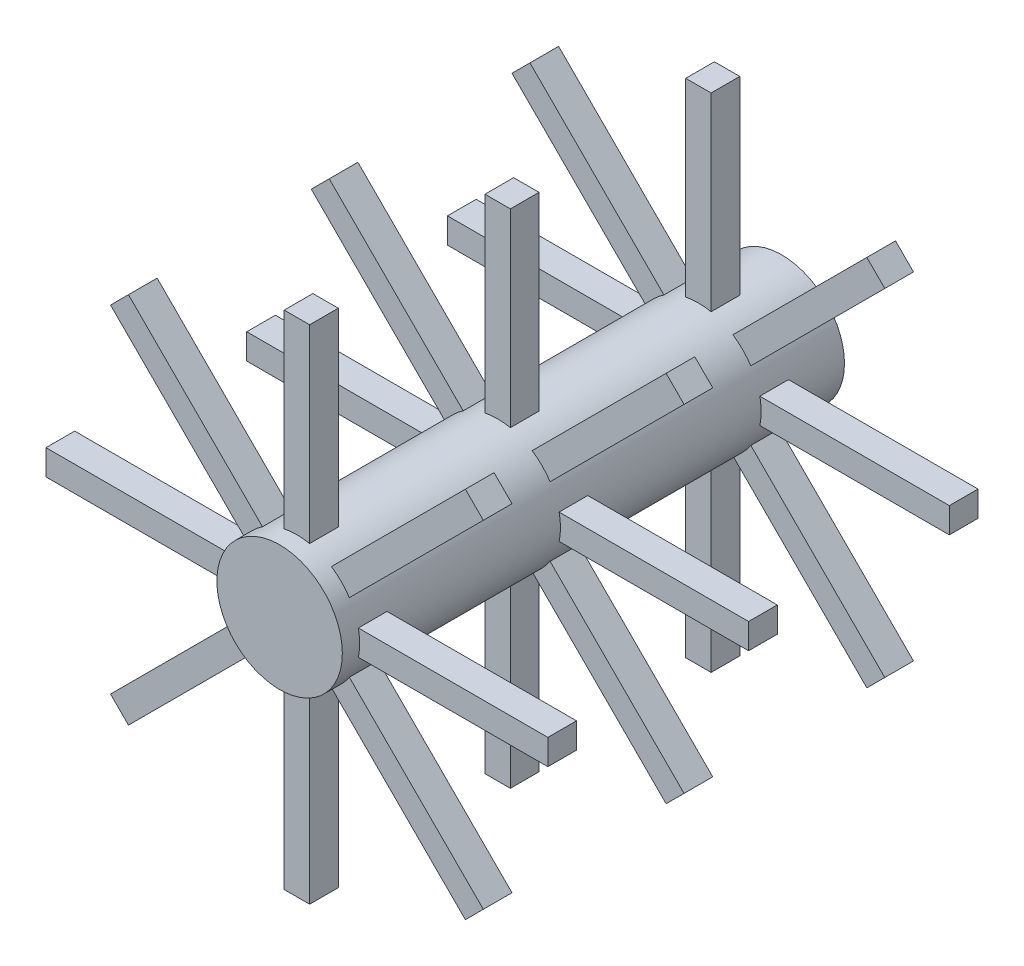
from build123d import *

# Parameters (mm, degrees)
SKETCH1_R                  = 25.4
BOSS_EXTRUDE1_DEPTH        = 203.31507114
SKETCH3_W                  = 11.610363297
SKETCH3_H                  = 10.2808948
BOSS_EXTRUDE3_DEPTH        = 101.6
CIRPATTERN4_COUNT          = 8
LPATTERN1_COUNT            = 3
LPATTERN1_PITCH            = 81.28
LPATTERN1_COPY_1_SKETCH_W  = 11.610363297
LPATTERN1_COPY_1_SKETCH_H  = 10.2808948
LPATTERN1_COPY_1_DEPTH     = 101.6
LPATTERN1_COPY_2_SKETCH_W  = 11.610363297
LPATTERN1_COPY_2_SKETCH_H  = 10.2808948
LPATTERN1_COPY_2_DEPTH     = 101.6
LPATTERN1_COPY_3_SKETCH_W  = 11.610363297
LPATTERN1_COPY_3_SKETCH_H  = 10.2808948
LPATTERN1_COPY_3_DEPTH     = 101.6
LPATTERN1_COPY_4_SKETCH_W  = 11.610363297
LPATTERN1_COPY_4_SKETCH_H  = 10.2808948
LPATTERN1_COPY_4_DEPTH     = 101.6
LPATTERN1_COPY_5_SKETCH_W  = 11.610363297
LPATTERN1_COPY_5_SKETCH_H  = 10.2808948
LPATTERN1_COPY_5_DEPTH     = 101.6
LPATTERN1_COPY_6_SKETCH_W  = 11.610363297
LPATTERN1_COPY_6_SKETCH_H  = 10.2808948
LPATTERN1_COPY_6_DEPTH     = 101.6
LPATTERN1_COPY_7_SKETCH_W  = 11.610363297
LPATTERN1_COPY_7_SKETCH_H  = 10.2808948
LPATTERN1_COPY_7_DEPTH     = 101.6
LPATTERN1_COPY_8_SKETCH_W  = 11.610363297
LPATTERN1_COPY_8_SKETCH_H  = 10.2808948
LPATTERN1_COPY_8_DEPTH     = 101.6
LPATTERN1_COPY_9_SKETCH_W  = 11.610363297
LPATTERN1_COPY_9_SKETCH_H  = 10.2808948
LPATTERN1_COPY_9_DEPTH     = 101.6
LPATTERN1_COPY_10_SKETCH_W = 11.610363297
LPATTERN1_COPY_10_SKETCH_H = 10.2808948
LPATTERN1_COPY_10_DEPTH    = 101.6
LPATTERN1_COPY_11_SKETCH_W = 11.610363297
LPATTERN1_COPY_11_SKETCH_H = 10.2808948
LPATTERN1_COPY_11_DEPTH    = 101.6
LPATTERN1_COPY_12_SKETCH_W = 11.610363297
LPATTERN1_COPY_12_SKETCH_H = 10.2808948
LPATTERN1_COPY_12_DEPTH    = 101.6
LPATTERN1_COPY_13_SKETCH_W = 11.610363297
LPATTERN1_COPY_13_SKETCH_H = 10.2808948
LPATTERN1_COPY_13_DEPTH    = 101.6
LPATTERN1_COPY_14_SKETCH_W = 11.610363297
LPATTERN1_COPY_14_SKETCH_H = 10.2808948
LPATTERN1_COPY_14_DEPTH    = 101.6


with BuildPart() as part:
    # Sketch1 → Boss-Extrude1 (new body)
    with BuildSketch(Plane.XY):
        with Locations(Location((0, 0, 0), (0, 0, 180))):
            Circle(SKETCH1_R)
    extrude(amount=BOSS_EXTRUDE1_DEPTH)

    # Sketch3 → Boss-Extrude3 (add)
    with BuildSketch(Plane(origin=(0, 0, 0), x_dir=(0, 0, -1), z_dir=(1, 0, 0))):
        with Locations((-190.503475636, 0)):
            Rectangle(SKETCH3_W, SKETCH3_H)
    boss_extrude3 = extrude(amount=BOSS_EXTRUDE3_DEPTH)

    # CirPattern4: Boss-Extrude3 ×8 about axis
    cirpattern4_axis = Axis((0, 0, 0), (0, 0, 1))
    for i in range(1, CIRPATTERN4_COUNT):
        add(boss_extrude3.rotate(cirpattern4_axis, i * 360 / CIRPATTERN4_COUNT))

    # LPattern1: Boss-Extrude3 ×3
    with Locations(*[(0, 0, -i * LPATTERN1_PITCH) for i in range(1, LPATTERN1_COUNT)]):
        add(boss_extrude3)

    # LPattern1 copy 1 sketch → LPattern1 copy 1 (add)
    with BuildSketch(Plane(origin=(0, 0, -81.28), x_dir=(0, 0, -1), z_dir=(0.7071067811865476, 0.7071067811865475, 0))):
        with Locations((-190.503475636, 0)):
            Rectangle(LPATTERN1_COPY_1_SKETCH_W, LPATTERN1_COPY_1_SKETCH_H)
    extrude(amount=LPATTERN1_COPY_1_DEPTH)

    # LPattern1 copy 2 sketch → LPattern1 copy 2 (add)
    with BuildSketch(Plane(origin=(0, 0, -162.56), x_dir=(0, 0, -1), z_dir=(0.7071067811865476, 0.7071067811865475, 0))):
        with Locations((-190.503475636, 0)):
            Rectangle(LPATTERN1_COPY_2_SKETCH_W, LPATTERN1_COPY_2_SKETCH_H)
    extrude(amount=LPATTERN1_COPY_2_DEPTH)

    # LPattern1 copy 3 sketch → LPattern1 copy 3 (add)
    with BuildSketch(Plane(origin=(0, 0, -81.28), x_dir=(0, 0, -1), z_dir=(0, 1, 0))):
        with Locations((-190.503475636, 0)):
            Rectangle(LPATTERN1_COPY_3_SKETCH_W, LPATTERN1_COPY_3_SKETCH_H)
    extrude(amount=LPATTERN1_COPY_3_DEPTH)

    # LPattern1 copy 4 sketch → LPattern1 copy 4 (add)
    with BuildSketch(Plane(origin=(0, 0, -162.56), x_dir=(0, 0, -1), z_dir=(0, 1, 0))):
        with Locations((-190.503475636, 0)):
            Rectangle(LPATTERN1_COPY_4_SKETCH_W, LPATTERN1_COPY_4_SKETCH_H)
    extrude(amount=LPATTERN1_COPY_4_DEPTH)

    # LPattern1 copy 5 sketch → LPattern1 copy 5 (add)
    with BuildSketch(Plane(origin=(0, 0, -81.28), x_dir=(0, 0, -1), z_dir=(-0.7071067811865475, 0.7071067811865476, 0))):
        with Locations((-190.503475636, 0)):
            Rectangle(LPATTERN1_COPY_5_SKETCH_W, LPATTERN1_COPY_5_SKETCH_H)
    extrude(amount=LPATTERN1_COPY_5_DEPTH)

    # LPattern1 copy 6 sketch → LPattern1 copy 6 (add)
    with BuildSketch(Plane(origin=(0, 0, -162.56), x_dir=(0, 0, -1), z_dir=(-0.7071067811865475, 0.7071067811865476, 0))):
        with Locations((-190.503475636, 0)):
            Rectangle(LPATTERN1_COPY_6_SKETCH_W, LPATTERN1_COPY_6_SKETCH_H)
    extrude(amount=LPATTERN1_COPY_6_DEPTH)

    # LPattern1 copy 7 sketch → LPattern1 copy 7 (add)
    with BuildSketch(Plane(origin=(0, 0, -81.28), x_dir=(0, 0, -1), z_dir=(-1, 0, 0))):
        with Locations((-190.503475636, 0)):
            Rectangle(LPATTERN1_COPY_7_SKETCH_W, LPATTERN1_COPY_7_SKETCH_H)
    extrude(amount=LPATTERN1_COPY_7_DEPTH)

    # LPattern1 copy 8 sketch → LPattern1 copy 8 (add)
    with BuildSketch(Plane(origin=(0, 0, -162.56), x_dir=(0, 0, -1), z_dir=(-1, 0, 0))):
        with Locations((-190.503475636, 0)):
            Rectangle(LPATTERN1_COPY_8_SKETCH_W, LPATTERN1_COPY_8_SKETCH_H)
    extrude(amount=LPATTERN1_COPY_8_DEPTH)

    # LPattern1 copy 9 sketch → LPattern1 copy 9 (add)
    with BuildSketch(Plane(origin=(0, 0, -81.28), x_dir=(0, 0, -1), z_dir=(-0.7071067811865477, -0.7071067811865475, 0))):
        with Locations((-190.503475636, 0)):
            Rectangle(LPATTERN1_COPY_9_SKETCH_W, LPATTERN1_COPY_9_SKETCH_H)
    extrude(amount=LPATTERN1_COPY_9_DEPTH)

    # LPattern1 copy 10 sketch → LPattern1 copy 10 (add)
    with BuildSketch(Plane(origin=(0, 0, -162.56), x_dir=(0, 0, -1), z_dir=(-0.7071067811865477, -0.7071067811865475, 0))):
        with Locations((-190.503475636, 0)):
            Rectangle(LPATTERN1_COPY_10_SKETCH_W, LPATTERN1_COPY_10_SKETCH_H)
    extrude(amount=LPATTERN1_COPY_10_DEPTH)

    # LPattern1 copy 11 sketch → LPattern1 copy 11 (add)
    with BuildSketch(Plane(origin=(0, 0, -81.28), x_dir=(0, 0, -1), z_dir=(0, -1, 0))):
        with Locations((-190.503475636, 0)):
            Rectangle(LPATTERN1_COPY_11_SKETCH_W, LPATTERN1_COPY_11_SKETCH_H)
    extrude(amount=LPATTERN1_COPY_11_DEPTH)

    # LPattern1 copy 12 sketch → LPattern1 copy 12 (add)
    with BuildSketch(Plane(origin=(0, 0, -162.56), x_dir=(0, 0, -1), z_dir=(0, -1, 0))):
        with Locations((-190.503475636, 0)):
            Rectangle(LPATTERN1_COPY_12_SKETCH_W, LPATTERN1_COPY_12_SKETCH_H)
    extrude(amount=LPATTERN1_COPY_12_DEPTH)

    # LPattern1 copy 13 sketch → LPattern1 copy 13 (add)
    with BuildSketch(Plane(origin=(0, 0, -81.28), x_dir=(0, 0, -1), z_dir=(0.7071067811865474, -0.7071067811865477, 0))):
        with Locations((-190.503475636, 0)):
            Rectangle(LPATTERN1_COPY_13_SKETCH_W, LPATTERN1_COPY_13_SKETCH_H)
    extrude(amount=LPATTERN1_COPY_13_DEPTH)

    # LPattern1 copy 14 sketch → LPattern1 copy 14 (add)
    with BuildSketch(Plane(origin=(0, 0, -162.56), x_dir=(0, 0, -1), z_dir=(0.7071067811865474, -0.7071067811865477, 0))):
        with Locations((-190.503475636, 0)):
            Rectangle(LPATTERN1_COPY_14_SKETCH_W, LPATTERN1_COPY_14_SKETCH_H)
    extrude(amount=LPATTERN1_COPY_14_DEPTH)


solid = part.part
